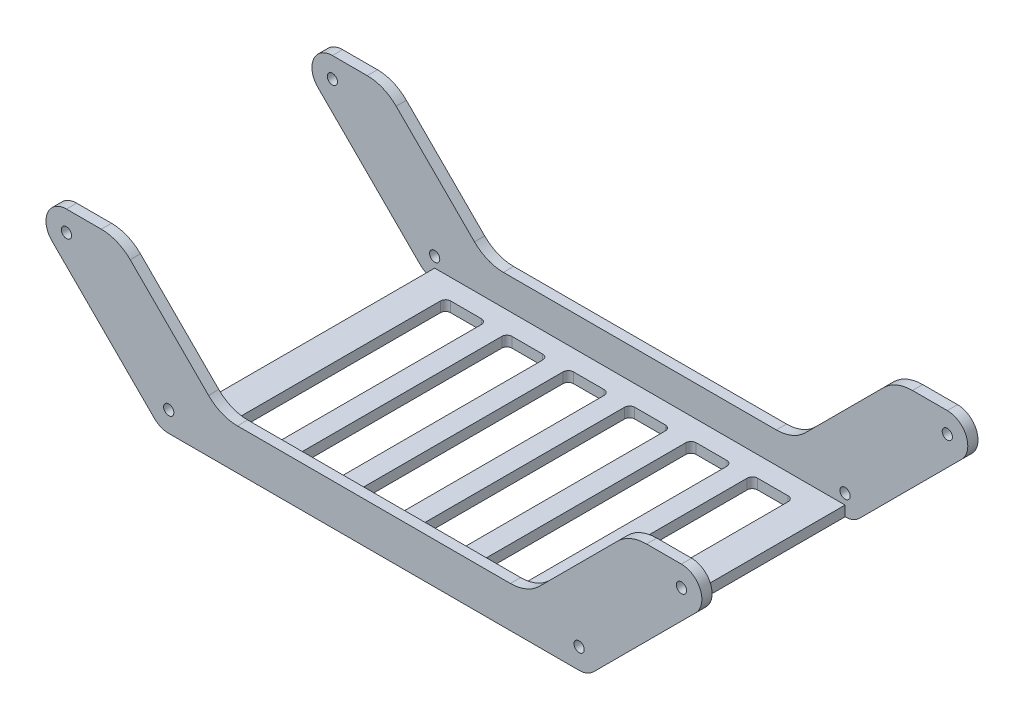
from build123d import *

# Parameters (mm, degrees)
SKETCH1_R           = 10
BOSS_EXTRUDE1_DEPTH = 20
SKETCH2_W           = 802.5
SKETCH2_H           = 500
BOSS_EXTRUDE3_DEPTH = 20


with BuildPart() as part:
    # Sketch1 → Boss-Extrude1 (new body)
    with BuildSketch(Plane.XY):
        with BuildLine():
            Line((-401.25, -40), (401.25, -40))
            ThreePointArc((401.25, -40), (416.557337295, -36.9551813), (429.534271247, -28.284271247))
            Line((429.534271247, -28.284271247), (629.534271247, 171.715728753))
            ThreePointArc((629.534271247, 171.715728753), (638.2051813, 215.307337295), (601.25, 240))
            Line((601.25, 240), (533.13708499, 240))
            ThreePointArc((533.13708499, 240), (502.522410401, 233.910362601), (476.568542495, 216.568542495))
            Line((476.568542495, 216.568542495), (323.431457505, 63.431457505))
            ThreePointArc((323.431457505, 63.431457505), (297.477589599, 46.089637399), (266.86291501, 40))
            Line((266.86291501, 40), (-266.86291501, 40))
            ThreePointArc((-266.86291501, 40), (-297.477589599, 46.089637399), (-323.431457505, 63.431457505))
            Line((-323.431457505, 63.431457505), (-476.568542495, 216.568542495))
            ThreePointArc((-476.568542495, 216.568542495), (-502.522410401, 233.910362601), (-533.13708499, 240))
            Line((-533.13708499, 240), (-601.25, 240))
            ThreePointArc((-601.25, 240), (-638.2051813, 215.307337295), (-629.534271247, 171.715728753))
            Line((-629.534271247, 171.715728753), (-429.534271247, -28.284271247))
            ThreePointArc((-429.534271247, -28.284271247), (-416.557337295, -36.9551813), (-401.25, -40))
        make_face()
        with Locations((601.25, 200)):
            Circle(SKETCH1_R, mode=Mode.SUBTRACT)
        with Locations((401.25, 0)):
            Circle(SKETCH1_R, mode=Mode.SUBTRACT)
        with Locations((-401.25, 0)):
            Circle(SKETCH1_R, mode=Mode.SUBTRACT)
        with Locations((-601.25, 200)):
            Circle(SKETCH1_R, mode=Mode.SUBTRACT)
    boss_extrude1 = extrude(amount=BOSS_EXTRUDE1_DEPTH)

    # Sketch2 → Boss-Extrude3 (add)
    with BuildSketch(Plane.XZ.offset(40)):
        with Locations((0, -250)):
            Rectangle(SKETCH2_W, SKETCH2_H)
        with BuildLine():
            Line((-330, -460), (-270, -460))
            ThreePointArc((-270, -460), (-262.928932188, -457.071067812), (-260, -450))
            Line((-260, -450), (-260, -50))
            ThreePointArc((-260, -50), (-262.928932188, -42.928932188), (-270, -40))
            Line((-270, -40), (-330, -40))
            ThreePointArc((-330, -40), (-337.071067812, -42.928932188), (-340, -50))
            Line((-340, -50), (-340, -450))
            ThreePointArc((-340, -450), (-337.071067812, -457.071067812), (-330, -460))
        make_face(mode=Mode.SUBTRACT)
        with BuildLine():
            Line((-220, -450), (-220, -50))
            ThreePointArc((-220, -50), (-217.071067812, -42.928932188), (-210, -40))
            Line((-210, -40), (-150, -40))
            ThreePointArc((-150, -40), (-142.928932188, -42.928932188), (-140, -50))
            Line((-140, -50), (-140, -450))
            ThreePointArc((-140, -450), (-142.928932188, -457.071067812), (-150, -460))
            Line((-150, -460), (-210, -460))
            ThreePointArc((-210, -460), (-217.071067812, -457.071067812), (-220, -450))
        make_face(mode=Mode.SUBTRACT)
        with BuildLine():
            Line((-100, -450), (-100, -50))
            ThreePointArc((-100, -50), (-97.071067812, -42.928932188), (-90, -40))
            Line((-90, -40), (-30, -40))
            ThreePointArc((-30, -40), (-22.928932188, -42.928932188), (-20, -50))
            Line((-20, -50), (-20, -450))
            ThreePointArc((-20, -450), (-22.928932188, -457.071067812), (-30, -460))
            Line((-30, -460), (-90, -460))
            ThreePointArc((-90, -460), (-97.071067812, -457.071067812), (-100, -450))
        make_face(mode=Mode.SUBTRACT)
        with BuildLine():
            Line((20, -450), (20, -50))
            ThreePointArc((20, -50), (22.928932188, -42.928932188), (30, -40))
            Line((30, -40), (90, -40))
            ThreePointArc((90, -40), (97.071067812, -42.928932188), (100, -50))
            Line((100, -50), (100, -450))
            ThreePointArc((100, -450), (97.071067812, -457.071067812), (90, -460))
            Line((90, -460), (30, -460))
            ThreePointArc((30, -460), (22.928932188, -457.071067812), (20, -450))
        make_face(mode=Mode.SUBTRACT)
        with BuildLine():
            Line((140, -450), (140, -50))
            ThreePointArc((140, -50), (142.928932188, -42.928932188), (150, -40))
            Line((150, -40), (210, -40))
            ThreePointArc((210, -40), (217.071067812, -42.928932188), (220, -50))
            Line((220, -50), (220, -450))
            ThreePointArc((220, -450), (217.071067812, -457.071067812), (210, -460))
            Line((210, -460), (150, -460))
            ThreePointArc((150, -460), (142.928932188, -457.071067812), (140, -450))
        make_face(mode=Mode.SUBTRACT)
        with BuildLine():
            Line((260, -450), (260, -50))
            ThreePointArc((260, -50), (262.928932188, -42.928932188), (270, -40))
            Line((270, -40), (330, -40))
            ThreePointArc((330, -40), (337.071067812, -42.928932188), (340, -50))
            Line((340, -50), (340, -450))
            ThreePointArc((340, -450), (337.071067812, -457.071067812), (330, -460))
            Line((330, -460), (270, -460))
            ThreePointArc((270, -460), (262.928932188, -457.071067812), (260, -450))
        make_face(mode=Mode.SUBTRACT)
    extrude(amount=-BOSS_EXTRUDE3_DEPTH)

    # Mirror1: Boss-Extrude1 across plane
    add(boss_extrude1.mirror(Plane(origin=(0, 0, -250), x_dir=(1, 0, 0), z_dir=(0, 0, -1))))


solid = part.part
